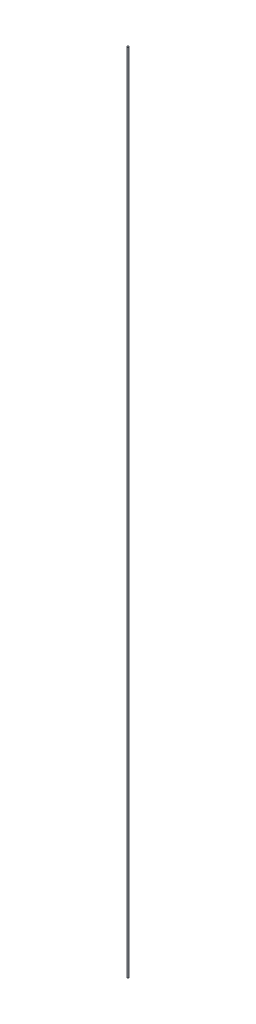
from build123d import *

# Parameters (mm, degrees)
ESQUISSE1_R             = 0.5
BOSS_EXTRU_1_DEPTH      = 580
ENL_V_START             = -80
ESQUISSE2_R             = 0.5
ENL_V_MAT_EXTRU_2_DEPTH = 80


with BuildPart() as part:
    # Esquisse1 → Boss.-Extru.1 (new body)
    with BuildSketch(Plane(origin=(0, 0, 0), x_dir=(1, 0, 0), z_dir=(0, 1, 0))):
        with Locations(Location((0, 0, 0), (0, 0, 270))):
            Circle(ESQUISSE1_R)
    extrude(amount=BOSS_EXTRU_1_DEPTH)

    # Esquisse2 → Enlèv. mat.-Extru.2 (cut)
    with BuildSketch(Plane(origin=(0, 580, 0), x_dir=(1, 0, 0), z_dir=(0, 1, 0)).offset(ENL_V_START)):
        with Locations(Location((0, 0, 0), (0, 0, 270))):
            Circle(ESQUISSE2_R)
    extrude(amount=ENL_V_MAT_EXTRU_2_DEPTH, mode=Mode.SUBTRACT)


solid = part.part
